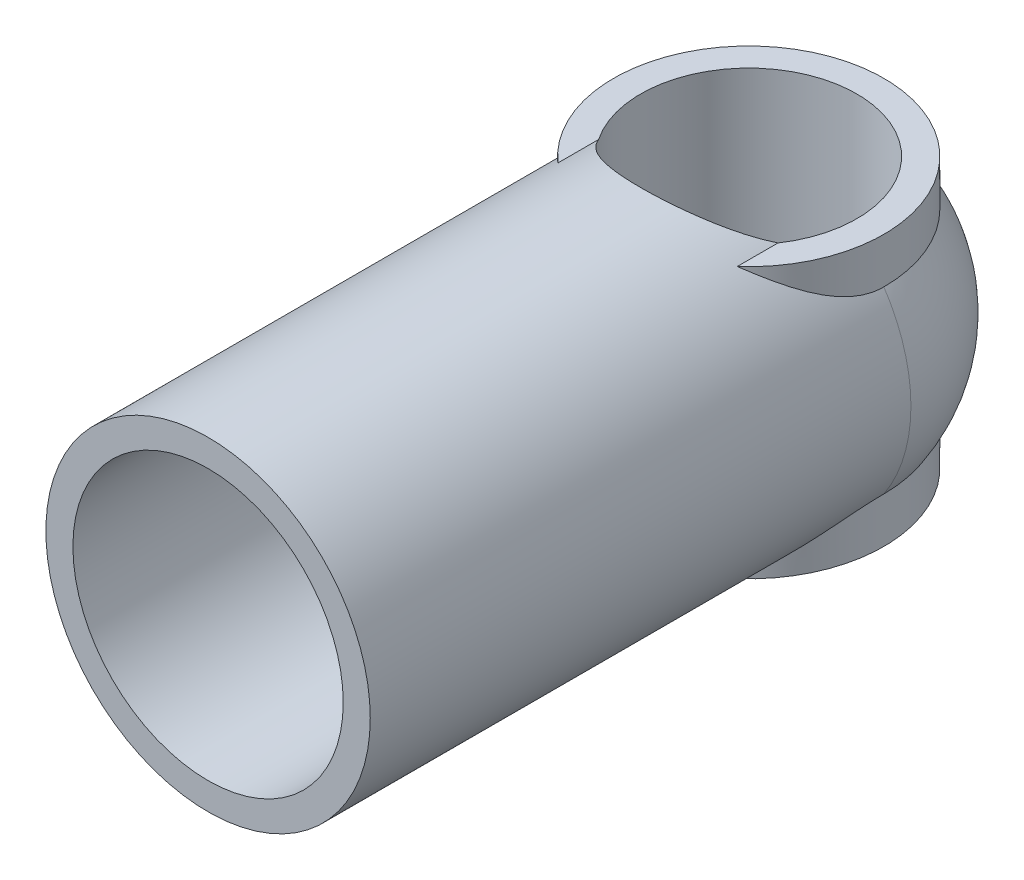
from build123d import *

# Parameters (mm, degrees)
SKETCH_1_R               = 12
SKETCH_1_R_2             = 10
EXTRUDE_1_DEPTH          = 40
SKETCH_3_R               = 10
SKETCH_3_R_2             = 8
EXTRUDE_2_DEPTH          = 10
CUT_EXTRUDE_1_DEPTH      = 44.451122112
CUT_EXTRUDE_1_DEPTH_BACK = 44.451122112
SKETCH_4_R               = 8


with BuildPart() as part:
    # 草图1 → 凸台-拉伸1 (new body)
    with BuildSketch(Plane.XY):
        Circle(SKETCH_1_R)
        Circle(SKETCH_1_R_2, mode=Mode.SUBTRACT)
    extrude(amount=EXTRUDE_1_DEPTH)

    # 草图2 → 旋转1 (revolve)
    with BuildSketch(Plane(origin=(0, 0, 0), x_dir=(1, 0, 0), z_dir=(0, 1, 0))):
        with BuildLine():
            Line((-12, 0), (-10, 0))
            ThreePointArc((-10, 0), (-7.071067812, 7.071067812), (0, 10))
            Line((0, 10), (0, 12))
            ThreePointArc((0, 12), (-8.485281374, 8.485281374), (-12, 0))
        make_face()
    revolve(axis=Axis((0, 0, -10), (0, 0, 1)))

    # 草图3 → 凸台-拉伸2 (add, symmetric)
    with BuildSketch(Plane(origin=(0, 0, 0), x_dir=(1, 0, 0), z_dir=(0, 1, 0))):
        Circle(SKETCH_3_R)
        with Locations(Location((0, 0, 0), (0, 0, 180))):
            Circle(SKETCH_3_R_2, mode=Mode.SUBTRACT)
    extrude(amount=EXTRUDE_2_DEPTH, both=True)

    # 草图4 → 切除-拉伸1 (cut, two sides: drawn at the far end of the back side and taken through both)
    with BuildSketch(Plane(origin=(0, 0, 0), x_dir=(1, 0, 0), z_dir=(0, 1, 0)).offset(-CUT_EXTRUDE_1_DEPTH_BACK)):
        with Locations(Location((0, 0, 0), (0, 0, 213.987843581))):
            Circle(SKETCH_4_R)
    extrude(amount=CUT_EXTRUDE_1_DEPTH + CUT_EXTRUDE_1_DEPTH_BACK, mode=Mode.SUBTRACT)


solid = part.part
